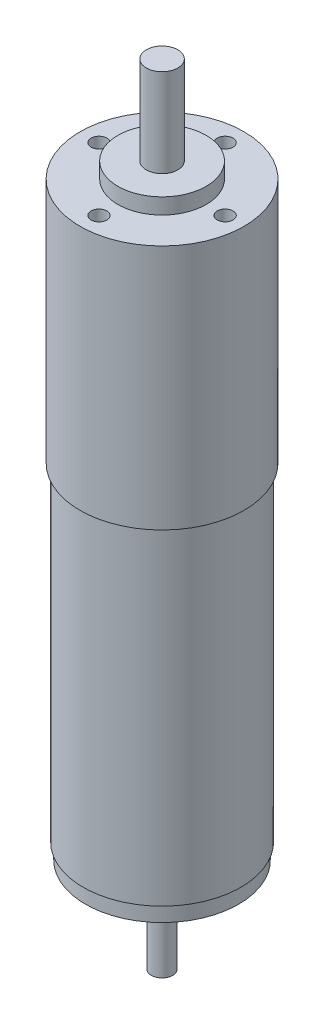
from build123d import *

# Parameters (mm, degrees)
ESQUISSE2_R             = 1.692758077
BOSS_EXTRU_1_DEPTH      = 15
ESQUISSE3_R             = 4
BOSS_EXTRU_2_DEPTH      = 2.5
ESQUISSE4_R             = 1.25
ENL_V_MAT_EXTRU_1_DEPTH = 5


with BuildPart() as part:
    # Esquisse1 → Révolution1 (revolve)
    with BuildSketch(Plane.XY, mode=Mode.PRIVATE) as r_volution1_sk:
        Polygon((0, 0), (12.15, 0), (12.15, 2.5), (12.5, 2.5), (12.5, 54.5), (13, 54.5), (13, 93.5), (7, 93.5), (7, 96), (2.5, 96), (2.5, 110), (0, 110), align=None)
    revolve(r_volution1_sk.sketch.rotate(Axis((0, 0, 0), (0, 1, 0)), 90), axis=Axis((0, 0, 0), (0, 1, 0)))

    # Esquisse2 → Boss.-Extru.1 (add)
    with BuildSketch(Plane.XZ):
        with Locations(Location((0, 0, 0), (0, 0, 270))):
            Circle(ESQUISSE2_R)
    extrude(amount=BOSS_EXTRU_1_DEPTH)

    # Esquisse3 → Boss.-Extru.2 (add)
    with BuildSketch(Plane.XZ):
        with Locations(Location((0, 0, 0), (0, 0, 270))):
            Circle(ESQUISSE3_R)
    extrude(amount=BOSS_EXTRU_2_DEPTH)

    # Esquisse4 → Enlèv. mat.-Extru.1 (cut)
    with BuildSketch(Plane(origin=(0, 93.5, 0), x_dir=(1, 0, 0), z_dir=(0, 1, 0))):
        with Locations(Location((0, 10, 0), (0, 0, 270))):
            Circle(ESQUISSE4_R)
        with Locations(Location((10, 0, 0), (0, 0, 270))):
            Circle(ESQUISSE4_R)
        with Locations(Location((0, -10, 0), (0, 0, 270))):
            Circle(ESQUISSE4_R)
        with Locations(Location((-10, 0, 0), (0, 0, 270))):
            Circle(ESQUISSE4_R)
    extrude(amount=-ENL_V_MAT_EXTRU_1_DEPTH, mode=Mode.SUBTRACT)


solid = part.part
